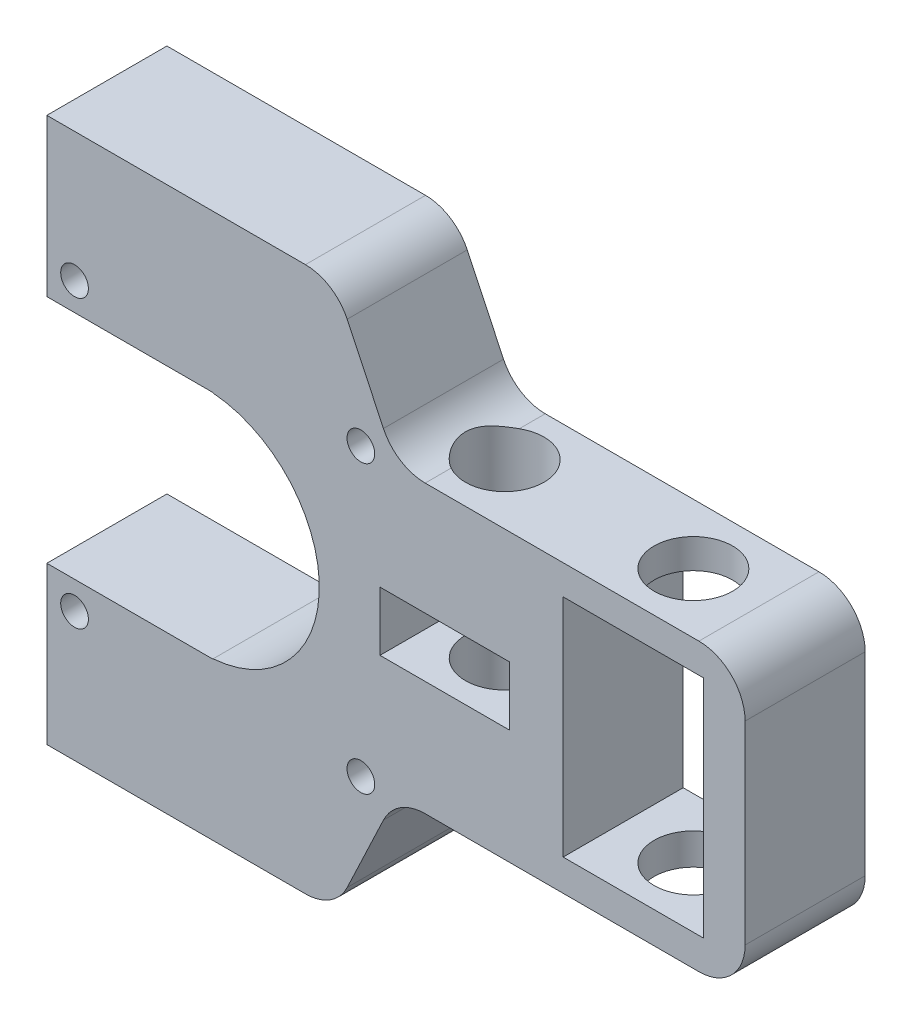
from build123d import *

# Parameters (mm, degrees)
CROQUIS2_R                 = 1.5
CROQUIS2_R_2               = 12.5
CROQUIS2_W                 = 14
CROQUIS2_H                 = 6.4
CROQUIS2_W_2               = 15.2
CROQUIS2_H_2               = 24.4
SALIENTE_EXTRUIR1_DEPTH    = 13
CROQUIS3_R                 = 4
CORTAR_EXTRUIR1_DEPTH      = 30
CROQUIS4_W                 = 13
CROQUIS4_H                 = 25
CORTAR_EXTRUIR2_DEPTH      = 18
CORTAR_EXTRUIR3_DEPTH      = 63.491392709
CORTAR_EXTRUIR3_DEPTH_BACK = 63.491392709
CROQUIS5_R                 = 4.25


with BuildPart() as part:
    # Croquis2 → Saliente-Extruir1 (new body)
    # profile 1 of 2: a face of its own
    with BuildSketch(Plane.XY):
        with BuildLine():
            Line((-41.366340939, 30.306283288), (-41.366340939, 19.306283288))
            Line((-41.366340939, 19.306283288), (-41.366340939, -17.693716712))
            Line((-41.366340939, -17.693716712), (-41.366340939, -28.693716712))
            Line((-41.366340939, -28.693716712), (-13.366340939, -28.693716712))
            ThreePointArc((-13.366340939, -28.693716712), (-10.693254692, -27.919188273), (-8.848320971, -25.835560677))
            Line((-8.848320971, -25.835560677), (-4.921298265, -17.551872747))
            ThreePointArc((-4.921298265, -17.551872747), (-3.076364545, -15.468245151), (-0.403278298, -14.693716712))
            Line((-0.403278298, -14.693716712), (29.233659061, -14.693716712))
            ThreePointArc((29.233659061, -14.693716712), (32.769192967, -13.229250618), (34.233659061, -9.693716712))
            Line((34.233659061, -9.693716712), (34.233659061, 11.306283288))
            ThreePointArc((34.233659061, 11.306283288), (32.769192967, 14.841817194), (29.233659061, 16.306283288))
            Line((29.233659061, 16.306283288), (-0.403278298, 16.306283288))
            ThreePointArc((-0.403278298, 16.306283288), (-3.076364545, 17.080811727), (-4.921298265, 19.164439323))
            Line((-4.921298265, 19.164439323), (-8.848320971, 27.448127253))
            ThreePointArc((-8.848320971, 27.448127253), (-10.693254692, 29.531754849), (-13.366340939, 30.306283288))
            Line((-13.366340939, 30.306283288), (-41.366340939, 30.306283288))
        make_face()
        with Locations(Location((-38.366340939, -14.693716712, 0), (0, 0, 180))):
            Circle(CROQUIS2_R, mode=Mode.SUBTRACT)
        with Locations(Location((-7.366340939, -14.693716712, 0), (0, 0, 180))):
            Circle(CROQUIS2_R, mode=Mode.SUBTRACT)
        with Locations(Location((-24.366340939, 0.806283288, 0), (0, 0, 180))):
            Circle(CROQUIS2_R_2, mode=Mode.SUBTRACT)
        with Locations(Location((-38.366340939, 16.306283288, 0), (0, 0, 180))):
            Circle(CROQUIS2_R, mode=Mode.SUBTRACT)
        with Locations(Location((-7.366340939, 16.306283288, 0), (0, 0, 180))):
            Circle(CROQUIS2_R, mode=Mode.SUBTRACT)
        with Locations((1.703659061, 0.906283288)):
            Rectangle(CROQUIS2_W, CROQUIS2_H, mode=Mode.SUBTRACT)
        with Locations((22.133659061, 0.906283288)):
            Rectangle(CROQUIS2_W_2, CROQUIS2_H_2, mode=Mode.SUBTRACT)
    # profile 2 of 2: a face of its own
    with BuildSketch(Plane.XY):
        with BuildLine():
            Line((-41.366340939, 30.306283288), (-41.366340939, 19.306283288))
            Line((-41.366340939, 19.306283288), (-41.366340939, -17.693716712))
            Line((-41.366340939, -17.693716712), (-41.366340939, -28.693716712))
            Line((-41.366340939, -28.693716712), (-13.366340939, -28.693716712))
            ThreePointArc((-13.366340939, -28.693716712), (-10.693254692, -27.919188273), (-8.848320971, -25.835560677))
            Line((-8.848320971, -25.835560677), (-4.921298265, -17.551872747))
            ThreePointArc((-4.921298265, -17.551872747), (-3.076364545, -15.468245151), (-0.403278298, -14.693716712))
            Line((-0.403278298, -14.693716712), (29.233659061, -14.693716712))
            ThreePointArc((29.233659061, -14.693716712), (32.769192967, -13.229250618), (34.233659061, -9.693716712))
            Line((34.233659061, -9.693716712), (34.233659061, 11.306283288))
            ThreePointArc((34.233659061, 11.306283288), (32.769192967, 14.841817194), (29.233659061, 16.306283288))
            Line((29.233659061, 16.306283288), (-0.403278298, 16.306283288))
            ThreePointArc((-0.403278298, 16.306283288), (-3.076364545, 17.080811727), (-4.921298265, 19.164439323))
            Line((-4.921298265, 19.164439323), (-8.848320971, 27.448127253))
            ThreePointArc((-8.848320971, 27.448127253), (-10.693254692, 29.531754849), (-13.366340939, 30.306283288))
            Line((-13.366340939, 30.306283288), (-41.366340939, 30.306283288))
        make_face()
        with Locations(Location((-38.366340939, -14.693716712, 0), (0, 0, 180))):
            Circle(CROQUIS2_R, mode=Mode.SUBTRACT)
        with Locations(Location((-7.366340939, -14.693716712, 0), (0, 0, 180))):
            Circle(CROQUIS2_R, mode=Mode.SUBTRACT)
        with Locations(Location((-24.366340939, 0.806283288, 0), (0, 0, 180))):
            Circle(CROQUIS2_R_2, mode=Mode.SUBTRACT)
        with Locations(Location((-38.366340939, 16.306283288, 0), (0, 0, 180))):
            Circle(CROQUIS2_R, mode=Mode.SUBTRACT)
        with Locations(Location((-7.366340939, 16.306283288, 0), (0, 0, 180))):
            Circle(CROQUIS2_R, mode=Mode.SUBTRACT)
        with Locations((1.703659061, 0.906283288)):
            Rectangle(CROQUIS2_W, CROQUIS2_H, mode=Mode.SUBTRACT)
        with Locations((22.133659061, 0.906283288)):
            Rectangle(CROQUIS2_W_2, CROQUIS2_H_2, mode=Mode.SUBTRACT)
    extrude(amount=SALIENTE_EXTRUIR1_DEPTH)

    # Croquis3 → Cortar-Extruir1 (cut)
    with BuildSketch(Plane.ZY.offset(41.366340939)):
        with Locations(Location((6.5, 23.806283288, 0), (0, 0, 270))):
            Circle(CROQUIS3_R)
        with Locations(Location((6.5, -22.193716712, 0), (0, 0, 270))):
            Circle(CROQUIS3_R)
    extrude(amount=-CORTAR_EXTRUIR1_DEPTH, mode=Mode.SUBTRACT)

    # Croquis4 → Cortar-Extruir2 (cut)
    with BuildSketch(Plane.ZY.offset(41.366340939)):
        with Locations((6.5, 0.806283288)):
            Rectangle(CROQUIS4_W, CROQUIS4_H)
    extrude(amount=-CORTAR_EXTRUIR2_DEPTH, mode=Mode.SUBTRACT)

    # Croquis5 → Cortar-Extruir3 (cut, two sides: drawn at the far end of the back side and taken through both)
    with BuildSketch(Plane(origin=(0, 16.306283288, 0), x_dir=(1, 0, 0), z_dir=(0, 1, 0)).offset(-CORTAR_EXTRUIR3_DEPTH_BACK)):
        with Locations(Location((22.133659061, -6.5, 0), (0, 0, 270))):
            Circle(CROQUIS5_R)
        with Locations(Location((1.703659061, -6.5, 0), (0, 0, 270))):
            Circle(CROQUIS5_R)
    extrude(amount=CORTAR_EXTRUIR3_DEPTH + CORTAR_EXTRUIR3_DEPTH_BACK, mode=Mode.SUBTRACT)


solid = part.part
